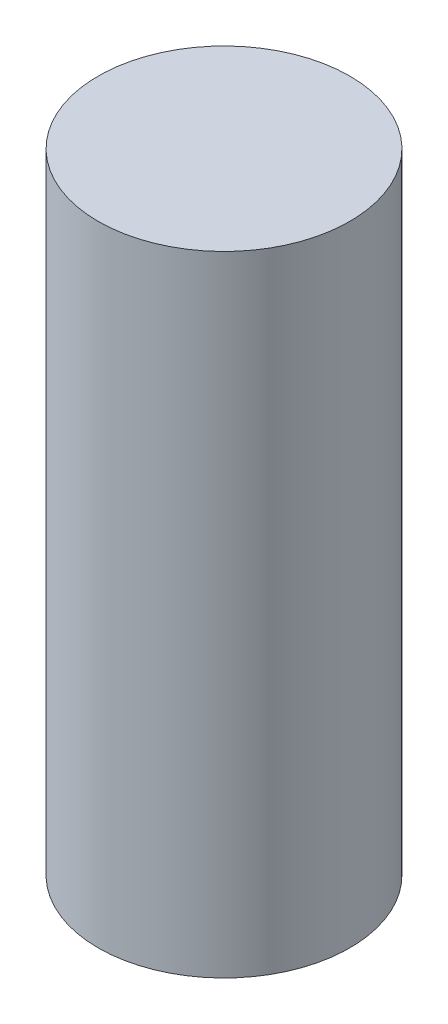
from build123d import *

# Parameters (mm, degrees)
SKETCH_1_R      = 5
EXTRUDE_1_DEPTH = 25


with BuildPart() as part:
    # 스케치1 → 보스-돌출1 (new body)
    with BuildSketch(Plane(origin=(0, 0, 0), x_dir=(1, 0, 0), z_dir=(0, 1, 0))):
        with Locations(Location((0, 0, 0), (0, 0, 270))):
            Circle(SKETCH_1_R)
    extrude(amount=EXTRUDE_1_DEPTH)


solid = part.part
